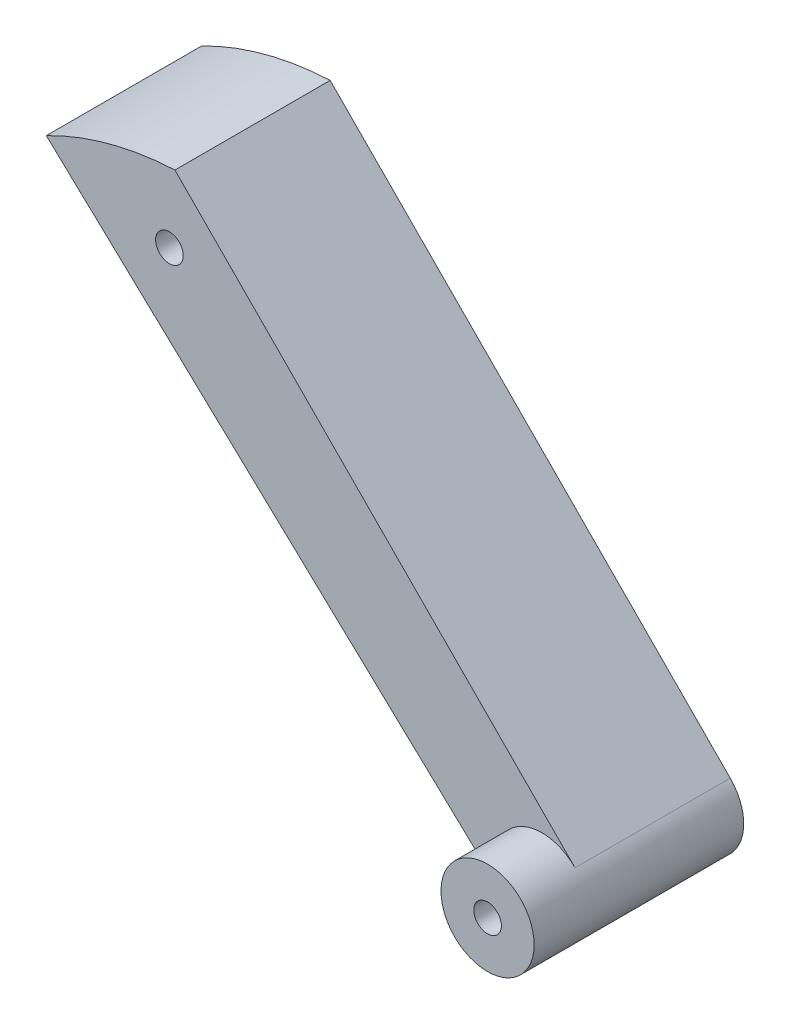
from build123d import *

# Parameters (mm, degrees)
SKETCH1_R      = 1.1303
SKETCH1_R_2    = 1.130299999
EXTRUDE1_DEPTH = 12.7
SKETCH2_R      = 3.810000001
SKETCH2_R_2    = 1.130299999
EXTRUDE2_DEPTH = 17.145


with BuildPart() as part:
    # Sketch1 → Extrude1 (new body)
    with BuildSketch(Plane.XY):
        with BuildLine():
            Line((286.542223003, 20.061166103), (324.474632327, -15.639737839))
            ThreePointArc((324.474632327, -15.639737839), (329.813577235, -15.525304753), (329.793827414, -10.185170147))
            Line((329.793827414, -10.185170147), (297.063524693, 22.885170148))
            ThreePointArc((297.063524693, 22.885170148), (291.649695142, 22.043861139), (286.542223003, 20.061166103))
        make_face()
        with Locations((296.613066371, 17.154306926)):
            Circle(SKETCH1_R, mode=Mode.SUBTRACT)
        with Locations((327.08586457, -12.865289034)):
            Circle(SKETCH1_R_2, mode=Mode.SUBTRACT)
    extrude(amount=EXTRUDE1_DEPTH)

    # Sketch2 → Extrude2 (add)
    with BuildSketch(Plane.XY):
        with Locations(Location((327.08586457, -12.865289034, 0), (0, 0, 226.735854521))):
            Circle(SKETCH2_R)
        with Locations((327.08586457, -12.865289034)):
            Circle(SKETCH2_R_2, mode=Mode.SUBTRACT)
    extrude(amount=EXTRUDE2_DEPTH)


solid = part.part
